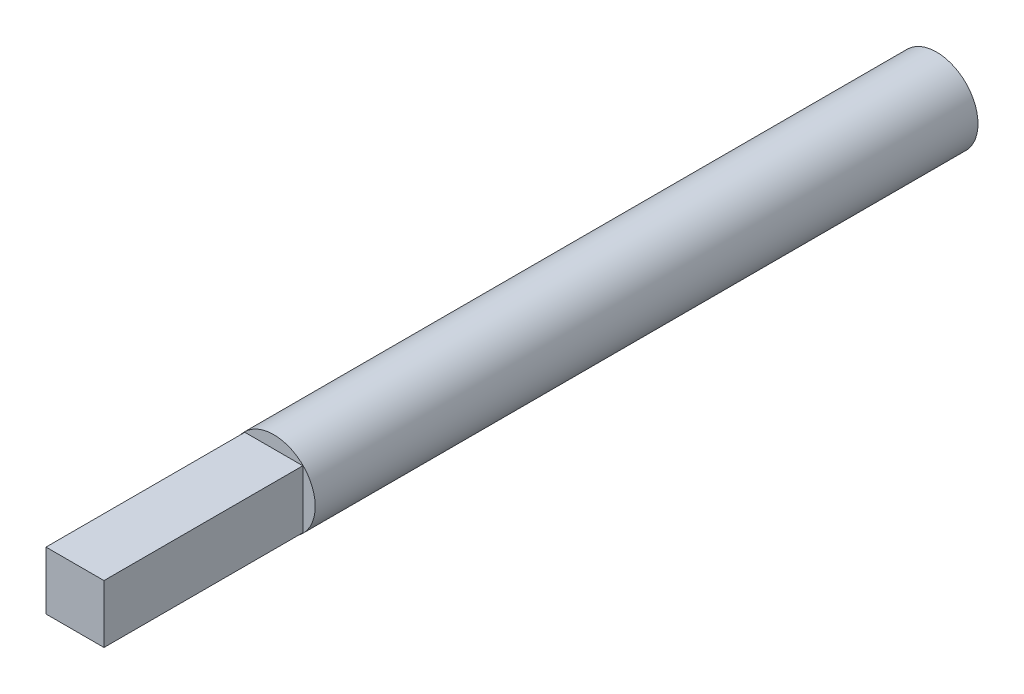
from build123d import *

# Parameters (mm, degrees)
SKETCH1_R           = 1.25
BOSS_EXTRUDE1_DEPTH = 5
SKETCH2_W           = 1.75
SKETCH2_H           = 1.75
BOSS_EXTRUDE2_DEPTH = 6
BOSS_EXTRUDE3_START = -15
SKETCH3_R           = 1.25
BOSS_EXTRUDE3_DEPTH = 15


with BuildPart() as part:
    # Sketch1 → Boss-Extrude1 (new body)
    with BuildSketch(Plane.XY):
        Circle(SKETCH1_R)
    extrude(amount=BOSS_EXTRUDE1_DEPTH)

    # Sketch2 → Boss-Extrude2 (add)
    with BuildSketch(Plane.XY.offset(5)):
        Rectangle(SKETCH2_W, SKETCH2_H)
    extrude(amount=BOSS_EXTRUDE2_DEPTH)

    # Sketch3 → Boss-Extrude3 (add)
    with BuildSketch(Plane.XY.offset(BOSS_EXTRUDE3_START)):
        Circle(SKETCH3_R)
    extrude(amount=BOSS_EXTRUDE3_DEPTH)


solid = part.part
